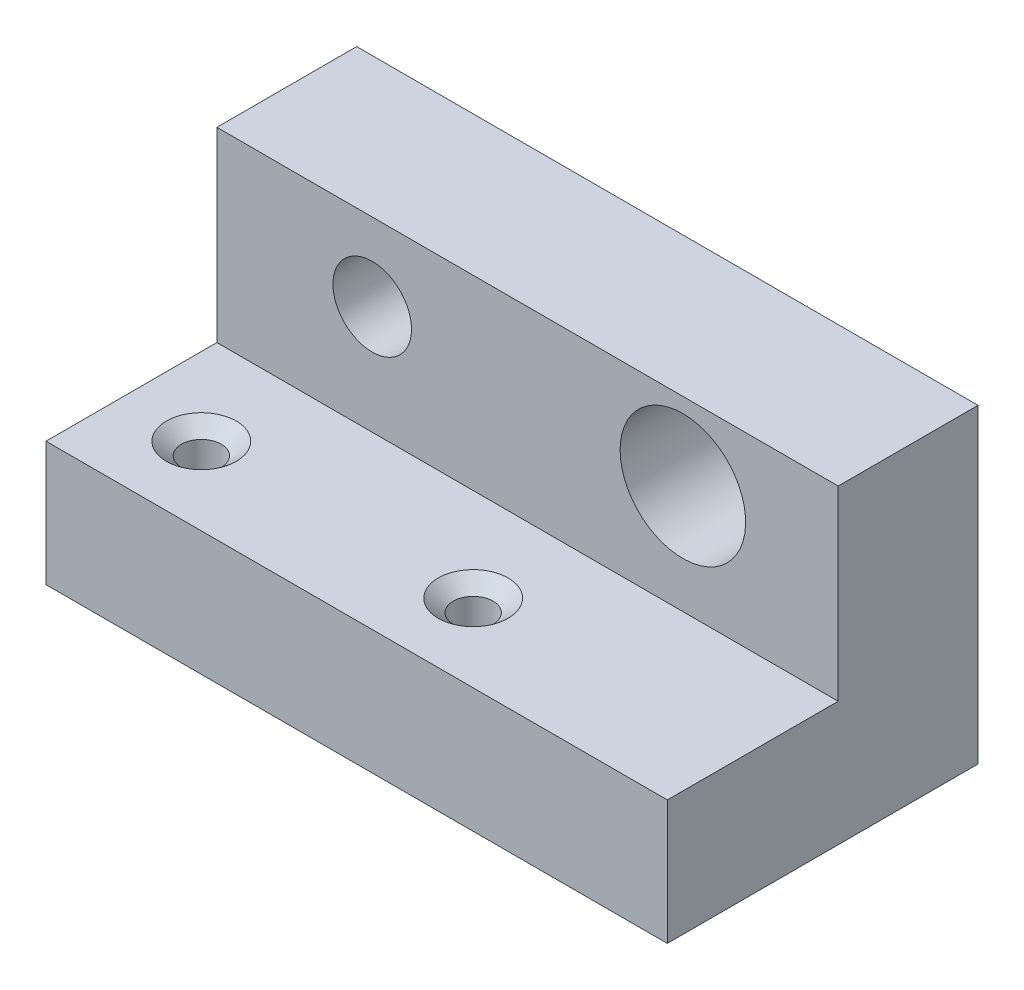
from build123d import *

# Parameters (mm, degrees)
BOSS_EXTRUDE1_DEPTH                               = 50.8
SKETCH3_R                                         = 3.2131
CUT_EXTRUDE1_DEPTH                                = 59.488981014
CSK_FOR_4_FLAT_HEAD_MACHINE_SCREW_100_D           = 3.2639
CSK_FOR_4_FLAT_HEAD_MACHINE_SCREW_100_CSINK_D     = 5.715
CSK_FOR_4_FLAT_HEAD_MACHINE_SCREW_100_CSINK_ANGLE = 100
Y_0_404_DIAMETER_HOLE1_D                          = 10.2616


with BuildPart() as part:
    # Sketch2 → Boss-Extrude1 (new body)
    with BuildSketch(Plane(origin=(0, 0, 0), x_dir=(0, 0, -1), z_dir=(1, 0, 0))):
        Polygon((0, 0), (0, 10.16), (13.97, 10.16), (13.97, 25.4), (25.4, 25.4), (25.4, 0), align=None)
    extrude(amount=BOSS_EXTRUDE1_DEPTH)

    # Sketch3 → Cut-Extrude1 (cut, through all)
    with BuildSketch(Plane.XY.offset(-13.97)):
        with Locations((12.7, 19.05)):
            Circle(SKETCH3_R)
    extrude(amount=-CUT_EXTRUDE1_DEPTH, mode=Mode.SUBTRACT)

    # CSK for #4 Flat Head Machine Screw (100)1 (through all)
    with Locations(Plane(origin=(0, 10.16, 0), x_dir=(1, 0, 0), z_dir=(0, 1, 0))):
        with Locations((6.35, 6.35), (28.575, 6.35)):
            CounterSinkHole(CSK_FOR_4_FLAT_HEAD_MACHINE_SCREW_100_D / 2, CSK_FOR_4_FLAT_HEAD_MACHINE_SCREW_100_CSINK_D / 2, counter_sink_angle=CSK_FOR_4_FLAT_HEAD_MACHINE_SCREW_100_CSINK_ANGLE)

    # Y (0.404) Diameter Hole1 (through all)
    with Locations(Plane(origin=(0, 0, -25.4), x_dir=(-1, 0, 0), z_dir=(0, 0, -1))):
        with Locations((-38.1, 19.05)):
            Hole(Y_0_404_DIAMETER_HOLE1_D / 2)


solid = part.part
